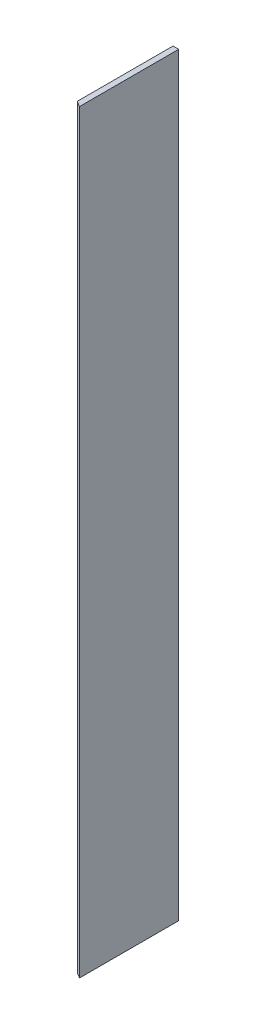
from build123d import *

# Parameters (mm, degrees)
EXTRUDE_1_DEPTH = 533


with BuildPart() as part:
    # Эскиз1 → Вытянуть1 (new body)
    with BuildSketch(Plane(origin=(0, 0, 0), x_dir=(1, 0, 0), z_dir=(0, 1, 0))):
        Polygon((1, 0), (5, 0), (5, -70.068808523), (1, -67.636001514), align=None)
    extrude(amount=EXTRUDE_1_DEPTH)


solid = part.part
